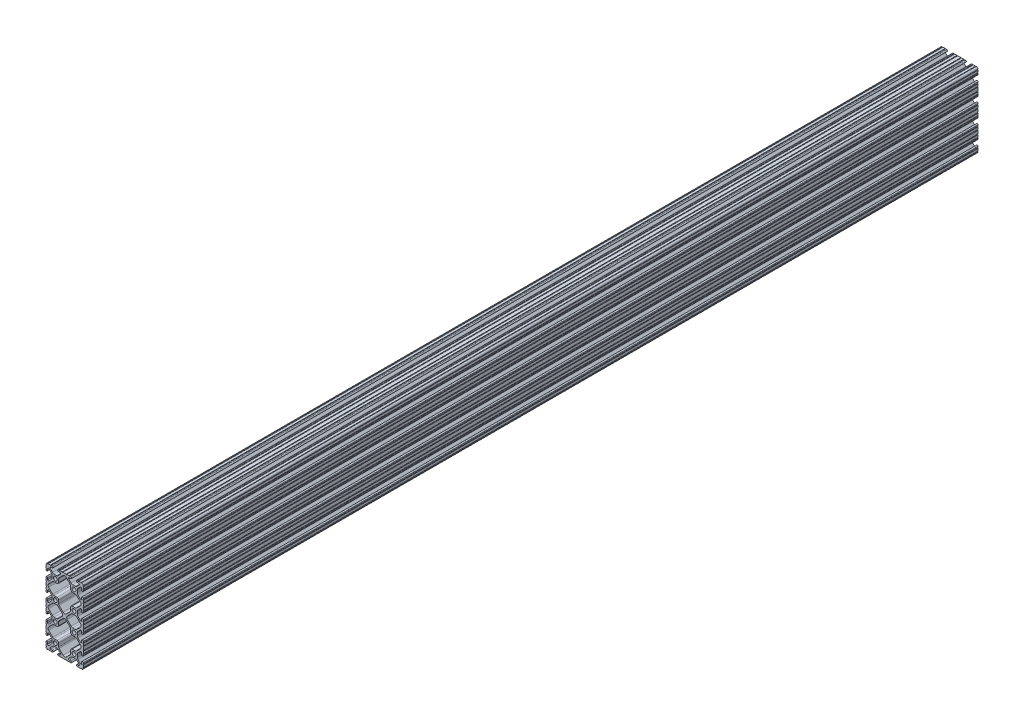
from build123d import *

# Parameters (mm, degrees)
SKETCH1_R      = 2.6035
EXTRUDE1_DEPTH = 1219.2


with BuildPart() as part:
    # Sketch1 → Extrude1 (new body)
    with BuildSketch(Plane.XY):
        with BuildLine():
            Line((-12.699984366, 40.2336), (-12.699984366, 35.9664))
            ThreePointArc((-12.699984366, 35.9664), (-12.192, 35.458392183), (-12.7, 34.9504))
            Line((-12.7, 34.9504), (-12.7, 32.004))
            ThreePointArc((-12.7, 32.004), (-12.192, 31.496), (-12.7, 30.988))
            Line((-12.7, 30.988), (-12.7, 29.7434))
            ThreePointArc((-12.7, 29.7434), (-11.5951, 28.6385), (-10.4902, 29.7434))
            Line((-10.4902, 29.7434), (-10.4902, 31.874256981))
            ThreePointArc((-10.4902, 31.874256981), (-9.863010627, 32.812916821), (-8.755786031, 32.592683991))
            Line((-8.755786031, 32.592683991), (-5.425756348, 29.262714761))
            ThreePointArc((-5.425756348, 29.262714761), (-4.737487999, 28.232663563), (-4.4958, 27.017630353))
            Line((-4.4958, 27.017630353), (-4.4958, 23.782369647))
            ThreePointArc((-4.4958, 23.782369647), (-4.737487999, 22.567336437), (-5.425756348, 21.537285239))
            Line((-5.425756348, 21.537285239), (-8.755786031, 18.207316009))
            ThreePointArc((-8.755786031, 18.207316009), (-9.863010627, 17.987083179), (-10.4902, 18.925743019))
            Line((-10.4902, 18.925743019), (-10.4902, 21.0566))
            ThreePointArc((-10.4902, 21.0566), (-11.5951, 22.1615), (-12.7, 21.0566))
            Line((-12.7, 21.0566), (-12.7, 19.812))
            ThreePointArc((-12.7, 19.812), (-12.192, 19.304), (-12.7, 18.796))
            Line((-12.7, 18.796), (-12.7, 15.8496))
            ThreePointArc((-12.7, 15.8496), (-12.192, 15.341607817), (-12.699984366, 14.8336))
            Line((-12.699984366, 14.8336), (-12.699984366, 10.5664))
            ThreePointArc((-12.699984366, 10.5664), (-12.192, 10.0584), (-12.699984366, 9.5504))
            Line((-12.699984366, 9.5504), (-12.699984366, 6.604))
            ThreePointArc((-12.699984366, 6.604), (-12.192, 6.095992183), (-12.7, 5.588))
            Line((-12.7, 5.588), (-12.7, 4.3434))
            ThreePointArc((-12.7, 4.3434), (-11.5951, 3.2385), (-10.4902, 4.3434))
            Line((-10.4902, 4.3434), (-10.4902, 6.474256981))
            ThreePointArc((-10.4902, 6.474256981), (-9.863010627, 7.412916821), (-8.755786031, 7.192683991))
            Line((-8.755786031, 7.192683991), (-5.425756348, 3.862714761))
            ThreePointArc((-5.425756348, 3.862714761), (-4.737487999, 2.832663563), (-4.4958, 1.617630353))
            Line((-4.4958, 1.617630353), (-4.4958, -1.617630353))
            ThreePointArc((-4.4958, -1.617630353), (-4.737487999, -2.832663563), (-5.425756348, -3.862714761))
            Line((-5.425756348, -3.862714761), (-8.755786031, -7.192683991))
            ThreePointArc((-8.755786031, -7.192683991), (-9.863010627, -7.412916821), (-10.4902, -6.474256981))
            Line((-10.4902, -6.474256981), (-10.4902, -4.3434))
            ThreePointArc((-10.4902, -4.3434), (-11.5951, -3.2385), (-12.7, -4.3434))
            Line((-12.7, -4.3434), (-12.7, -5.588))
            ThreePointArc((-12.7, -5.588), (-12.192, -6.096), (-12.7, -6.604))
            Line((-12.7, -6.604), (-12.7, -9.5504))
            ThreePointArc((-12.7, -9.5504), (-12.192000007, -10.058315768), (-12.699831537, -10.566399972))
            ThreePointArc((-12.699831537, -10.566399972), (-12.082506882, -12.082506882), (-10.566399972, -12.699831537))
            ThreePointArc((-10.566399972, -12.699831537), (-10.058315768, -12.192000007), (-9.5504, -12.7))
            Line((-9.5504, -12.7), (-6.604, -12.7))
            ThreePointArc((-6.604, -12.7), (-6.096, -12.192), (-5.588, -12.7))
            Line((-5.588, -12.7), (-4.3434, -12.7))
            ThreePointArc((-4.3434, -12.7), (-3.2385, -11.5951), (-4.3434, -10.4902))
            Line((-4.3434, -10.4902), (-6.474256981, -10.4902))
            ThreePointArc((-6.474256981, -10.4902), (-7.412916821, -9.863010627), (-7.192683991, -8.755786031))
            Line((-7.192683991, -8.755786031), (-3.862714761, -5.425756348))
            ThreePointArc((-3.862714761, -5.425756348), (-2.832663563, -4.737487999), (-1.617630353, -4.4958))
            Line((-1.617630353, -4.4958), (1.617630353, -4.4958))
            ThreePointArc((1.617630353, -4.4958), (2.832663563, -4.737487999), (3.862714761, -5.425756348))
            Line((3.862714761, -5.425756348), (7.192683991, -8.755786031))
            ThreePointArc((7.192683991, -8.755786031), (7.412916821, -9.863010627), (6.474256981, -10.4902))
            Line((6.474256981, -10.4902), (4.3434, -10.4902))
            ThreePointArc((4.3434, -10.4902), (3.2385, -11.5951), (4.3434, -12.7))
            Line((4.3434, -12.7), (5.588, -12.7))
            ThreePointArc((5.588, -12.7), (6.096, -12.192), (6.604, -12.7))
            Line((6.604, -12.7), (9.5504, -12.7))
            ThreePointArc((9.5504, -12.7), (10.0584, -12.192), (10.5664, -12.7))
            Line((10.5664, -12.7), (14.8336, -12.7))
            ThreePointArc((14.8336, -12.7), (15.3416, -12.192), (15.8496, -12.7))
            Line((15.8496, -12.7), (18.796, -12.7))
            ThreePointArc((18.796, -12.7), (19.304, -12.192), (19.812, -12.7))
            Line((19.812, -12.7), (21.0566, -12.7))
            ThreePointArc((21.0566, -12.7), (22.1615, -11.5951), (21.0566, -10.4902))
            Line((21.0566, -10.4902), (18.925743019, -10.4902))
            ThreePointArc((18.925743019, -10.4902), (17.987083179, -9.863010627), (18.207316009, -8.755786031))
            Line((18.207316009, -8.755786031), (21.537285239, -5.425756348))
            ThreePointArc((21.537285239, -5.425756348), (22.567336437, -4.737487999), (23.782369647, -4.4958))
            Line((23.782369647, -4.4958), (27.017630353, -4.4958))
            ThreePointArc((27.017630353, -4.4958), (28.232663563, -4.737487999), (29.262714761, -5.425756348))
            Line((29.262714761, -5.425756348), (32.592683991, -8.755786031))
            ThreePointArc((32.592683991, -8.755786031), (32.812916821, -9.863010627), (31.874256981, -10.4902))
            Line((31.874256981, -10.4902), (29.7434, -10.4902))
            ThreePointArc((29.7434, -10.4902), (28.6385, -11.5951), (29.7434, -12.7))
            Line((29.7434, -12.7), (30.988, -12.7))
            ThreePointArc((30.988, -12.7), (31.496, -12.192), (32.004, -12.7))
            Line((32.004, -12.7), (34.9504, -12.7))
            ThreePointArc((34.9504, -12.7), (35.458315768, -12.192000007), (35.966399972, -12.699831537))
            ThreePointArc((35.966399972, -12.699831537), (37.482506882, -12.082506882), (38.099831537, -10.566399972))
            ThreePointArc((38.099831537, -10.566399972), (37.592000007, -10.058315768), (38.1, -9.5504))
            Line((38.1, -9.5504), (38.1, -6.604))
            ThreePointArc((38.1, -6.604), (37.592, -6.096), (38.1, -5.588))
            Line((38.1, -5.588), (38.1, -4.3434))
            ThreePointArc((38.1, -4.3434), (36.9951, -3.2385), (35.8902, -4.3434))
            Line((35.8902, -4.3434), (35.8902, -6.474256981))
            ThreePointArc((35.8902, -6.474256981), (35.263010627, -7.412916821), (34.155786031, -7.192683991))
            Line((34.155786031, -7.192683991), (30.825756348, -3.862714761))
            ThreePointArc((30.825756348, -3.862714761), (30.137487999, -2.832663563), (29.8958, -1.617630353))
            Line((29.8958, -1.617630353), (29.8958, 1.617630353))
            ThreePointArc((29.8958, 1.617630353), (30.137487999, 2.832663563), (30.825756348, 3.862714761))
            Line((30.825756348, 3.862714761), (34.155786031, 7.192683991))
            ThreePointArc((34.155786031, 7.192683991), (35.263010627, 7.412916821), (35.8902, 6.474256981))
            Line((35.8902, 6.474256981), (35.8902, 4.3434))
            ThreePointArc((35.8902, 4.3434), (36.9951, 3.2385), (38.1, 4.3434))
            Line((38.1, 4.3434), (38.1, 5.588))
            ThreePointArc((38.1, 5.588), (37.592, 6.096), (38.1, 6.604))
            Line((38.1, 6.604), (38.1, 9.5504))
            ThreePointArc((38.1, 9.5504), (37.592, 10.058392183), (38.099984366, 10.5664))
            Line((38.099984366, 10.5664), (38.099984366, 14.8336))
            ThreePointArc((38.099984366, 14.8336), (37.592, 15.3416), (38.099984366, 15.8496))
            Line((38.099984366, 15.8496), (38.099984366, 18.796))
            ThreePointArc((38.099984366, 18.796), (37.592, 19.304007817), (38.1, 19.812))
            Line((38.1, 19.812), (38.1, 21.0566))
            ThreePointArc((38.1, 21.0566), (36.9951, 22.1615), (35.8902, 21.0566))
            Line((35.8902, 21.0566), (35.8902, 18.925743019))
            ThreePointArc((35.8902, 18.925743019), (35.263010627, 17.987083179), (34.155786031, 18.207316009))
            Line((34.155786031, 18.207316009), (30.825756348, 21.537285239))
            ThreePointArc((30.825756348, 21.537285239), (30.137487999, 22.567336437), (29.8958, 23.782369647))
            Line((29.8958, 23.782369647), (29.8958, 27.017630353))
            ThreePointArc((29.8958, 27.017630353), (30.137487999, 28.232663563), (30.825756348, 29.262714761))
            Line((30.825756348, 29.262714761), (34.155786031, 32.592683991))
            ThreePointArc((34.155786031, 32.592683991), (35.263010627, 32.812916821), (35.8902, 31.874256981))
            Line((35.8902, 31.874256981), (35.8902, 29.7434))
            ThreePointArc((35.8902, 29.7434), (36.9951, 28.6385), (38.1, 29.7434))
            Line((38.1, 29.7434), (38.1, 30.988))
            ThreePointArc((38.1, 30.988), (37.592, 31.495992183), (38.099984366, 32.004))
            Line((38.099984366, 32.004), (38.099984366, 34.9504))
            ThreePointArc((38.099984366, 34.9504), (37.592, 35.4584), (38.099984366, 35.9664))
            Line((38.099984366, 35.9664), (38.099984366, 40.2336))
            ThreePointArc((38.099984366, 40.2336), (37.592, 40.7416), (38.099984366, 41.2496))
            Line((38.099984366, 41.2496), (38.099984366, 44.196))
            ThreePointArc((38.099984366, 44.196), (37.592, 44.704007817), (38.1, 45.212))
            Line((38.1, 45.212), (38.1, 46.4566))
            ThreePointArc((38.1, 46.4566), (36.9951, 47.5615), (35.8902, 46.4566))
            Line((35.8902, 46.4566), (35.8902, 44.325743019))
            ThreePointArc((35.8902, 44.325743019), (35.263010627, 43.387083179), (34.155786031, 43.607316009))
            Line((34.155786031, 43.607316009), (30.825756348, 46.937285239))
            ThreePointArc((30.825756348, 46.937285239), (30.137487999, 47.967336437), (29.8958, 49.182369647))
            Line((29.8958, 49.182369647), (29.8958, 52.417630353))
            ThreePointArc((29.8958, 52.417630353), (30.137487999, 53.632663563), (30.825756348, 54.662714761))
            Line((30.825756348, 54.662714761), (34.155786031, 57.992683991))
            ThreePointArc((34.155786031, 57.992683991), (35.263010627, 58.212916821), (35.8902, 57.274256981))
            Line((35.8902, 57.274256981), (35.8902, 55.1434))
            ThreePointArc((35.8902, 55.1434), (36.9951, 54.0385), (38.1, 55.1434))
            Line((38.1, 55.1434), (38.1, 56.388))
            ThreePointArc((38.1, 56.388), (37.592, 56.896), (38.1, 57.404))
            Line((38.1, 57.404), (38.1, 60.3504))
            ThreePointArc((38.1, 60.3504), (37.592, 60.858392183), (38.099984366, 61.3664))
            Line((38.099984366, 61.3664), (38.099984366, 65.6336))
            ThreePointArc((38.099984366, 65.6336), (37.592, 66.141607817), (38.1, 66.6496))
            Line((38.1, 66.6496), (38.1, 69.596))
            ThreePointArc((38.1, 69.596), (37.592, 70.104), (38.1, 70.612))
            Line((38.1, 70.612), (38.1, 71.8566))
            ThreePointArc((38.1, 71.8566), (36.9951, 72.9615), (35.8902, 71.8566))
            Line((35.8902, 71.8566), (35.8902, 69.725743019))
            ThreePointArc((35.8902, 69.725743019), (35.263010627, 68.787083179), (34.155786031, 69.007316009))
            Line((34.155786031, 69.007316009), (30.825756348, 72.337285239))
            ThreePointArc((30.825756348, 72.337285239), (30.137487999, 73.367336437), (29.8958, 74.582369647))
            Line((29.8958, 74.582369647), (29.8958, 77.817630353))
            ThreePointArc((29.8958, 77.817630353), (30.137487999, 79.032663563), (30.825756348, 80.062714761))
            Line((30.825756348, 80.062714761), (34.155786031, 83.392683991))
            ThreePointArc((34.155786031, 83.392683991), (35.263010627, 83.612916821), (35.8902, 82.674256981))
            Line((35.8902, 82.674256981), (35.8902, 80.5434))
            ThreePointArc((35.8902, 80.5434), (36.9951, 79.4385), (38.1, 80.5434))
            Line((38.1, 80.5434), (38.1, 81.788))
            ThreePointArc((38.1, 81.788), (37.592, 82.296), (38.1, 82.804))
            Line((38.1, 82.804), (38.1, 85.7504))
            ThreePointArc((38.1, 85.7504), (37.592000007, 86.258315768), (38.099831537, 86.766399972))
            ThreePointArc((38.099831537, 86.766399972), (37.482506882, 88.282506882), (35.966399972, 88.899831537))
            ThreePointArc((35.966399972, 88.899831537), (35.458315768, 88.392000007), (34.9504, 88.9))
            Line((34.9504, 88.9), (32.004, 88.9))
            ThreePointArc((32.004, 88.9), (31.496, 88.392), (30.988, 88.9))
            Line((30.988, 88.9), (29.7434, 88.9))
            ThreePointArc((29.7434, 88.9), (28.6385, 87.7951), (29.7434, 86.6902))
            Line((29.7434, 86.6902), (31.874256981, 86.6902))
            ThreePointArc((31.874256981, 86.6902), (32.812916821, 86.063010627), (32.592683991, 84.955786031))
            Line((32.592683991, 84.955786031), (29.262714761, 81.625756348))
            ThreePointArc((29.262714761, 81.625756348), (28.232663563, 80.937487999), (27.017630353, 80.6958))
            Line((27.017630353, 80.6958), (23.782369647, 80.6958))
            ThreePointArc((23.782369647, 80.6958), (22.567336437, 80.937487999), (21.537285239, 81.625756348))
            Line((21.537285239, 81.625756348), (18.207316009, 84.955786031))
            ThreePointArc((18.207316009, 84.955786031), (17.987083179, 86.063010627), (18.925743019, 86.6902))
            Line((18.925743019, 86.6902), (21.0566, 86.6902))
            ThreePointArc((21.0566, 86.6902), (22.1615, 87.7951), (21.0566, 88.9))
            Line((21.0566, 88.9), (19.812, 88.9))
            ThreePointArc((19.812, 88.9), (19.304, 88.392), (18.796, 88.9))
            Line((18.796, 88.9), (15.8496, 88.9))
            ThreePointArc((15.8496, 88.9), (15.3416, 88.392), (14.8336, 88.9))
            Line((14.8336, 88.9), (10.5664, 88.9))
            ThreePointArc((10.5664, 88.9), (10.0584, 88.392), (9.5504, 88.9))
            Line((9.5504, 88.9), (6.604, 88.9))
            ThreePointArc((6.604, 88.9), (6.096, 88.392), (5.588, 88.9))
            Line((5.588, 88.9), (4.3434, 88.9))
            ThreePointArc((4.3434, 88.9), (3.2385, 87.7951), (4.3434, 86.6902))
            Line((4.3434, 86.6902), (6.474256981, 86.6902))
            ThreePointArc((6.474256981, 86.6902), (7.412916821, 86.063010627), (7.192683991, 84.955786031))
            Line((7.192683991, 84.955786031), (3.862714761, 81.625756348))
            ThreePointArc((3.862714761, 81.625756348), (2.832663563, 80.937487999), (1.617630353, 80.6958))
            Line((1.617630353, 80.6958), (-1.617630353, 80.6958))
            ThreePointArc((-1.617630353, 80.6958), (-2.832663563, 80.937487999), (-3.862714761, 81.625756348))
            Line((-3.862714761, 81.625756348), (-7.192683991, 84.955786031))
            ThreePointArc((-7.192683991, 84.955786031), (-7.412916821, 86.063010627), (-6.474256981, 86.6902))
            Line((-6.474256981, 86.6902), (-4.3434, 86.6902))
            ThreePointArc((-4.3434, 86.6902), (-3.2385, 87.7951), (-4.3434, 88.9))
            Line((-4.3434, 88.9), (-5.588, 88.9))
            ThreePointArc((-5.588, 88.9), (-6.096, 88.392), (-6.604, 88.9))
            Line((-6.604, 88.9), (-9.5504, 88.9))
            ThreePointArc((-9.5504, 88.9), (-10.058315768, 88.392000007), (-10.566399972, 88.899831537))
            ThreePointArc((-10.566399972, 88.899831537), (-12.082506882, 88.282506882), (-12.699831537, 86.766399972))
            ThreePointArc((-12.699831537, 86.766399972), (-12.192000007, 86.258315768), (-12.7, 85.7504))
            Line((-12.7, 85.7504), (-12.7, 82.804))
            ThreePointArc((-12.7, 82.804), (-12.192, 82.296), (-12.7, 81.788))
            Line((-12.7, 81.788), (-12.7, 80.5434))
            ThreePointArc((-12.7, 80.5434), (-11.5951, 79.4385), (-10.4902, 80.5434))
            Line((-10.4902, 80.5434), (-10.4902, 82.674256981))
            ThreePointArc((-10.4902, 82.674256981), (-9.863010627, 83.612916821), (-8.755786031, 83.392683991))
            Line((-8.755786031, 83.392683991), (-5.425756348, 80.062714761))
            ThreePointArc((-5.425756348, 80.062714761), (-4.737487999, 79.032663563), (-4.4958, 77.817630353))
            Line((-4.4958, 77.817630353), (-4.4958, 74.582369647))
            ThreePointArc((-4.4958, 74.582369647), (-4.737487999, 73.367336437), (-5.425756348, 72.337285239))
            Line((-5.425756348, 72.337285239), (-8.755786031, 69.007316009))
            ThreePointArc((-8.755786031, 69.007316009), (-9.863010627, 68.787083179), (-10.4902, 69.725743019))
            Line((-10.4902, 69.725743019), (-10.4902, 71.8566))
            ThreePointArc((-10.4902, 71.8566), (-11.5951, 72.9615), (-12.7, 71.8566))
            Line((-12.7, 71.8566), (-12.7, 70.612))
            ThreePointArc((-12.7, 70.612), (-12.192, 70.104), (-12.7, 69.596))
            Line((-12.7, 69.596), (-12.7, 66.6496))
            ThreePointArc((-12.7, 66.6496), (-12.192, 66.141607817), (-12.699984366, 65.6336))
            Line((-12.699984366, 65.6336), (-12.699984366, 61.3664))
            ThreePointArc((-12.699984366, 61.3664), (-12.192, 60.858392183), (-12.7, 60.3504))
            Line((-12.7, 60.3504), (-12.7, 57.404))
            ThreePointArc((-12.7, 57.404), (-12.192, 56.896), (-12.7, 56.388))
            Line((-12.7, 56.388), (-12.7, 55.1434))
            ThreePointArc((-12.7, 55.1434), (-11.5951, 54.0385), (-10.4902, 55.1434))
            Line((-10.4902, 55.1434), (-10.4902, 57.274256981))
            ThreePointArc((-10.4902, 57.274256981), (-9.863010627, 58.212916821), (-8.755786031, 57.992683991))
            Line((-8.755786031, 57.992683991), (-5.425756348, 54.662714761))
            ThreePointArc((-5.425756348, 54.662714761), (-4.737487999, 53.632663563), (-4.4958, 52.417630353))
            Line((-4.4958, 52.417630353), (-4.4958, 49.182369647))
            ThreePointArc((-4.4958, 49.182369647), (-4.737487999, 47.967336437), (-5.425756348, 46.937285239))
            Line((-5.425756348, 46.937285239), (-8.755786031, 43.607316009))
            ThreePointArc((-8.755786031, 43.607316009), (-9.863010627, 43.387083179), (-10.4902, 44.325743019))
            Line((-10.4902, 44.325743019), (-10.4902, 46.4566))
            ThreePointArc((-10.4902, 46.4566), (-11.5951, 47.5615), (-12.7, 46.4566))
            Line((-12.7, 46.4566), (-12.7, 45.212))
            ThreePointArc((-12.7, 45.212), (-12.192, 44.704), (-12.7, 44.196))
            Line((-12.7, 44.196), (-12.7, 41.2496))
            ThreePointArc((-12.7, 41.2496), (-12.192, 40.741607817), (-12.699984366, 40.2336))
        make_face()
        with Locations((25.4, 76.2)):
            Circle(SKETCH1_R, mode=Mode.SUBTRACT)
        with Locations((0, 76.2)):
            Circle(SKETCH1_R, mode=Mode.SUBTRACT)
        with Locations((25.4, 50.8)):
            Circle(SKETCH1_R, mode=Mode.SUBTRACT)
        with Locations((0, 50.8)):
            Circle(SKETCH1_R, mode=Mode.SUBTRACT)
        with Locations((25.4, 0)):
            Circle(SKETCH1_R, mode=Mode.SUBTRACT)
        Circle(SKETCH1_R, mode=Mode.SUBTRACT)
        with Locations((25.4, 25.4)):
            Circle(SKETCH1_R, mode=Mode.SUBTRACT)
        with Locations((0, 25.4)):
            Circle(SKETCH1_R, mode=Mode.SUBTRACT)
        with BuildLine():
            Line((2.286, 55.2958), (-2.018378203, 55.2958))
            ThreePointArc((-2.018378203, 55.2958), (-2.864022786, 55.464007171), (-3.580928584, 55.943021252))
            Line((-3.580928584, 55.943021252), (-9.072529371, 61.434522344))
            ThreePointArc((-9.072529371, 61.434522344), (-9.928089211, 63.5), (-9.072529371, 65.565477656))
            Line((-9.072529371, 65.565477656), (-3.580928584, 71.056978748))
            ThreePointArc((-3.580928584, 71.056978748), (-2.864022786, 71.535992829), (-2.018378203, 71.7042))
            Line((-2.018378203, 71.7042), (2.286, 71.7042))
            ThreePointArc((2.286, 71.7042), (3.848564565, 72.351435435), (4.4958, 73.914))
            Line((4.4958, 73.914), (4.4958, 78.218378203))
            ThreePointArc((4.4958, 78.218378203), (4.664007171, 79.064022786), (5.143021252, 79.780928584))
            Line((5.143021252, 79.780928584), (10.634522344, 85.272529371))
            ThreePointArc((10.634522344, 85.272529371), (12.7, 86.128089211), (14.765477656, 85.272529371))
            Line((14.765477656, 85.272529371), (20.256978748, 79.780928584))
            ThreePointArc((20.256978748, 79.780928584), (20.735992829, 79.064022786), (20.9042, 78.218378203))
            Line((20.9042, 78.218378203), (20.9042, 73.914))
            ThreePointArc((20.9042, 73.914), (21.551435435, 72.351435435), (23.114, 71.7042))
            Line((23.114, 71.7042), (27.418378203, 71.7042))
            ThreePointArc((27.418378203, 71.7042), (28.264022786, 71.535992829), (28.980928584, 71.056978748))
            Line((28.980928584, 71.056978748), (34.472529371, 65.565477656))
            ThreePointArc((34.472529371, 65.565477656), (35.328089211, 63.5), (34.472529371, 61.434522344))
            Line((34.472529371, 61.434522344), (28.980928584, 55.943021252))
            ThreePointArc((28.980928584, 55.943021252), (28.264022786, 55.464007171), (27.418378203, 55.2958))
            Line((27.418378203, 55.2958), (23.114, 55.2958))
            ThreePointArc((23.114, 55.2958), (21.551435435, 54.648564565), (20.9042, 53.086))
            Line((20.9042, 53.086), (20.9042, 48.781621797))
            ThreePointArc((20.9042, 48.781621797), (20.735992829, 47.935977214), (20.256978748, 47.219071416))
            Line((20.256978748, 47.219071416), (14.765477656, 41.727470629))
            ThreePointArc((14.765477656, 41.727470629), (12.7, 40.871910789), (10.634522344, 41.727470629))
            Line((10.634522344, 41.727470629), (5.143021252, 47.219071416))
            ThreePointArc((5.143021252, 47.219071416), (4.664007171, 47.935977214), (4.4958, 48.781621797))
            Line((4.4958, 48.781621797), (4.4958, 53.086))
            ThreePointArc((4.4958, 53.086), (3.848564565, 54.648564565), (2.286, 55.2958))
        make_face(mode=Mode.SUBTRACT)
        with BuildLine():
            Line((4.4958, 23.114), (4.4958, 27.418378203))
            ThreePointArc((4.4958, 27.418378203), (4.664007171, 28.264022786), (5.143021252, 28.980928584))
            Line((5.143021252, 28.980928584), (10.634522344, 34.472529371))
            ThreePointArc((10.634522344, 34.472529371), (12.7, 35.328089211), (14.765477656, 34.472529371))
            Line((14.765477656, 34.472529371), (20.256978748, 28.980928584))
            ThreePointArc((20.256978748, 28.980928584), (20.735992829, 28.264022786), (20.9042, 27.418378203))
            Line((20.9042, 27.418378203), (20.9042, 23.114))
            ThreePointArc((20.9042, 23.114), (21.551435435, 21.551435435), (23.114, 20.9042))
            Line((23.114, 20.9042), (27.418378203, 20.9042))
            ThreePointArc((27.418378203, 20.9042), (28.264022786, 20.735992829), (28.980928584, 20.256978748))
            Line((28.980928584, 20.256978748), (34.472529371, 14.765477656))
            ThreePointArc((34.472529371, 14.765477656), (35.328089211, 12.7), (34.472529371, 10.634522344))
            Line((34.472529371, 10.634522344), (28.980928584, 5.143021252))
            ThreePointArc((28.980928584, 5.143021252), (28.264022786, 4.664007171), (27.418378203, 4.4958))
            Line((27.418378203, 4.4958), (23.114, 4.4958))
            ThreePointArc((23.114, 4.4958), (21.551435435, 3.848564565), (20.9042, 2.286))
            Line((20.9042, 2.286), (20.9042, -2.018378203))
            ThreePointArc((20.9042, -2.018378203), (20.735992829, -2.864022786), (20.256978748, -3.580928584))
            Line((20.256978748, -3.580928584), (14.765477656, -9.072529371))
            ThreePointArc((14.765477656, -9.072529371), (12.7, -9.928089211), (10.634522344, -9.072529371))
            Line((10.634522344, -9.072529371), (5.143021252, -3.580928584))
            ThreePointArc((5.143021252, -3.580928584), (4.664007171, -2.864022786), (4.4958, -2.018378203))
            Line((4.4958, -2.018378203), (4.4958, 2.286))
            ThreePointArc((4.4958, 2.286), (3.848564565, 3.848564565), (2.286, 4.4958))
            Line((2.286, 4.4958), (-2.018378203, 4.4958))
            ThreePointArc((-2.018378203, 4.4958), (-2.864022786, 4.664007171), (-3.580928584, 5.143021252))
            Line((-3.580928584, 5.143021252), (-9.072529371, 10.634522344))
            ThreePointArc((-9.072529371, 10.634522344), (-9.928089211, 12.7), (-9.072529371, 14.765477656))
            Line((-9.072529371, 14.765477656), (-3.580928584, 20.256978748))
            ThreePointArc((-3.580928584, 20.256978748), (-2.864022786, 20.735992829), (-2.018378203, 20.9042))
            Line((-2.018378203, 20.9042), (2.286, 20.9042))
            ThreePointArc((2.286, 20.9042), (3.848564565, 21.551435435), (4.4958, 23.114))
        make_face(mode=Mode.SUBTRACT)
        with BuildLine():
            Line((27.018584404, 29.8958), (23.782369647, 29.8958))
            ThreePointArc((23.782369647, 29.8958), (22.567336437, 30.137487999), (21.537285239, 30.825756348))
            Line((21.537285239, 30.825756348), (16.328576307, 36.03455984))
            ThreePointArc((16.328576307, 36.03455984), (15.473053963, 38.1), (16.328576307, 40.16544016))
            Line((16.328576307, 40.16544016), (21.537285239, 45.374243652))
            ThreePointArc((21.537285239, 45.374243652), (22.567336437, 46.062512001), (23.782369647, 46.3042))
            Line((23.782369647, 46.3042), (27.018584404, 46.3042))
            ThreePointArc((27.018584404, 46.3042), (28.233590989, 46.06252303), (29.263628056, 45.374284409))
            Line((29.263628056, 45.374284409), (34.472529371, 40.165477656))
            ThreePointArc((34.472529371, 40.165477656), (35.328089211, 38.1), (34.472529371, 36.034522344))
            Line((34.472529371, 36.034522344), (29.263628056, 30.825715591))
            ThreePointArc((29.263628056, 30.825715591), (28.233590989, 30.13747697), (27.018584404, 29.8958))
        make_face(mode=Mode.SUBTRACT)
        with BuildLine():
            Line((1.617630353, 29.8958), (-1.618584404, 29.8958))
            ThreePointArc((-1.618584404, 29.8958), (-2.833590989, 30.13747697), (-3.863628056, 30.825715591))
            Line((-3.863628056, 30.825715591), (-9.072529371, 36.034522344))
            ThreePointArc((-9.072529371, 36.034522344), (-9.928089211, 38.1), (-9.072529371, 40.165477656))
            Line((-9.072529371, 40.165477656), (-3.863628056, 45.374284409))
            ThreePointArc((-3.863628056, 45.374284409), (-2.833590989, 46.06252303), (-1.618584404, 46.3042))
            Line((-1.618584404, 46.3042), (1.617630353, 46.3042))
            ThreePointArc((1.617630353, 46.3042), (2.832663563, 46.062512001), (3.862714761, 45.374243652))
            Line((3.862714761, 45.374243652), (9.071423693, 40.16544016))
            ThreePointArc((9.071423693, 40.16544016), (9.926946037, 38.1), (9.071423693, 36.03455984))
            Line((9.071423693, 36.03455984), (3.862714761, 30.825756348))
            ThreePointArc((3.862714761, 30.825756348), (2.832663563, 30.137487999), (1.617630353, 29.8958))
        make_face(mode=Mode.SUBTRACT)
    extrude(amount=-EXTRUDE1_DEPTH)


solid = part.part
